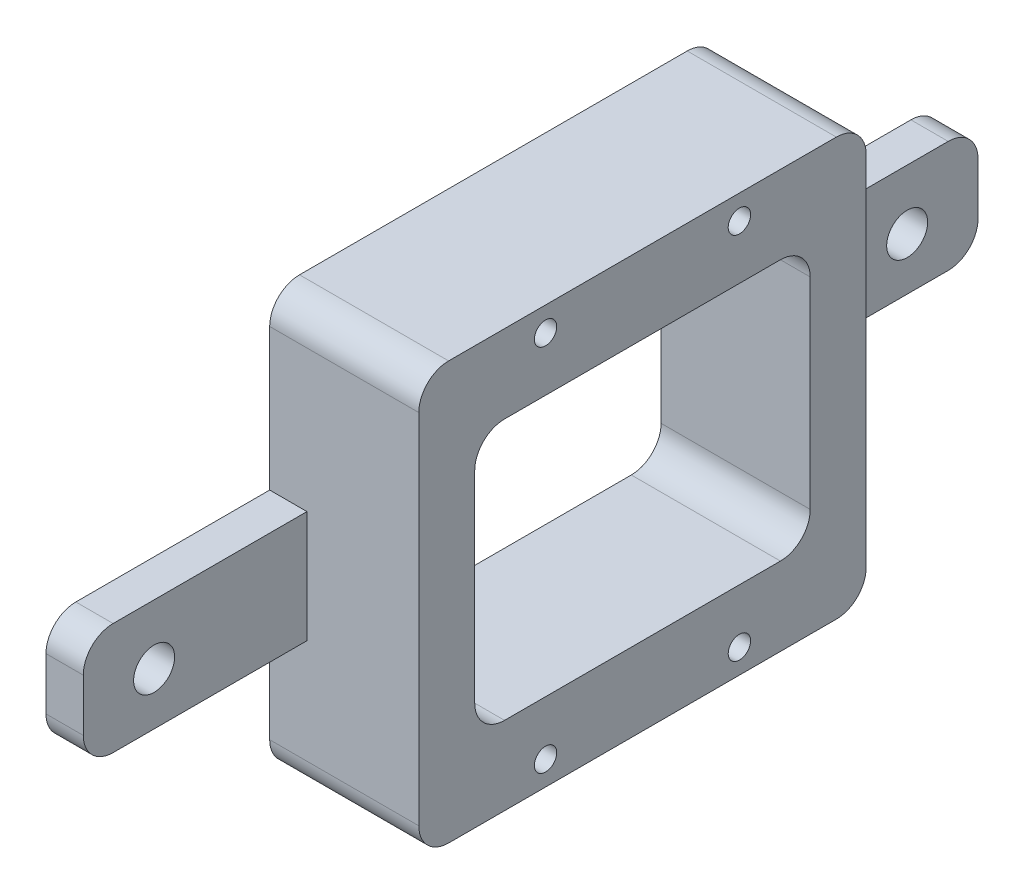
from build123d import *

# Parameters (mm, degrees)
SKETCH_1_W          = 60
SKETCH_1_H          = 56
EXTRUDE_1_DEPTH     = 20
EXTRUDE_START       = -15
SKETCH_6_W          = 30
SKETCH_6_H          = 15
EXTRUDE_3_DEPTH     = 5
SKETCH_7_R          = 1.5
CUT_EXTRUDE_2_DEPTH = 70.166465863
CUT_EXTRUDE_START   = -15
SKETCH_8_R          = 2.75
CUT_EXTRUDE_3_DEPTH = 5
FILLET_2_R          = 4
SKETCH_9_W          = 45
SKETCH_9_H          = 35
CUT_EXTRUDE_4_DEPTH = 70.166465863
FILLET_3_R          = 4


with BuildPart() as part:
    # 草图1 → 凸台-拉伸1 (new body)
    with BuildSketch(Plane(origin=(0, 0, 0), x_dir=(0, 0, -1), z_dir=(1, 0, 0))):
        Rectangle(SKETCH_1_W, SKETCH_1_H)
    extrude(amount=EXTRUDE_1_DEPTH)

    # 草图6 → 凸台-拉伸3 (add)
    with BuildSketch(Plane(origin=(20, 0, 0), x_dir=(0, 0, -1), z_dir=(1, 0, 0)).offset(EXTRUDE_START)):
        with Locations((45, -2.5)):
            Rectangle(SKETCH_6_W, SKETCH_6_H)
        with Locations((-45, -2.5)):
            Rectangle(SKETCH_6_W, SKETCH_6_H)
    extrude(amount=-EXTRUDE_3_DEPTH)

    # 草图7 → 切除-拉伸2 (cut, through all)
    with BuildSketch(Plane(origin=(20, 0, 0), x_dir=(0, 0, -1), z_dir=(1, 0, 0))):
        with Locations((-13, 24.75)):
            Circle(SKETCH_7_R)
        with Locations((13, 24.75)):
            Circle(SKETCH_7_R)
        with Locations((13, -24.75)):
            Circle(SKETCH_7_R)
        with Locations((-13, -24.75)):
            Circle(SKETCH_7_R)
    extrude(amount=-CUT_EXTRUDE_2_DEPTH, mode=Mode.SUBTRACT)

    # 草图8 → 切除-拉伸3 (cut)
    with BuildSketch(Plane(origin=(20, 0, 0), x_dir=(0, 0, -1), z_dir=(1, 0, 0)).offset(CUT_EXTRUDE_START)):
        with Locations((-50.5, -3)):
            Circle(SKETCH_8_R)
        with Locations((50.5, -3)):
            Circle(SKETCH_8_R)
    extrude(amount=-CUT_EXTRUDE_3_DEPTH, mode=Mode.SUBTRACT)

    # 圆角2
    fillet_2_edges = [part.edges().sort_by_distance(p)[0] for p in [
        (2.5, 5, -60),
        (2.5, -10, -60),
        (2.5, -10, 60),
        (2.5, 5, 60),
        (10, 28, 30),
        (10, 28, -30),
        (10, -28, -30),
        (10, -28, 30),
    ]]
    fillet(fillet_2_edges, radius=FILLET_2_R)

    # 草图9 → 切除-拉伸4 (cut, through all)
    with BuildSketch(Plane(origin=(20, 0, 0), x_dir=(0, 0, -1), z_dir=(1, 0, 0))):
        Rectangle(SKETCH_9_W, SKETCH_9_H)
    extrude(amount=-CUT_EXTRUDE_4_DEPTH, mode=Mode.SUBTRACT)

    # 圆角3
    fillet_3_edges = [part.edges().sort_by_distance(p)[0] for p in [
        (10, -17.5, 22.5),
        (10, 17.5, 22.5),
        (10, 17.5, -22.5),
        (10, -17.5, -22.5),
    ]]
    fillet(fillet_3_edges, radius=FILLET_3_R)


solid = part.part
